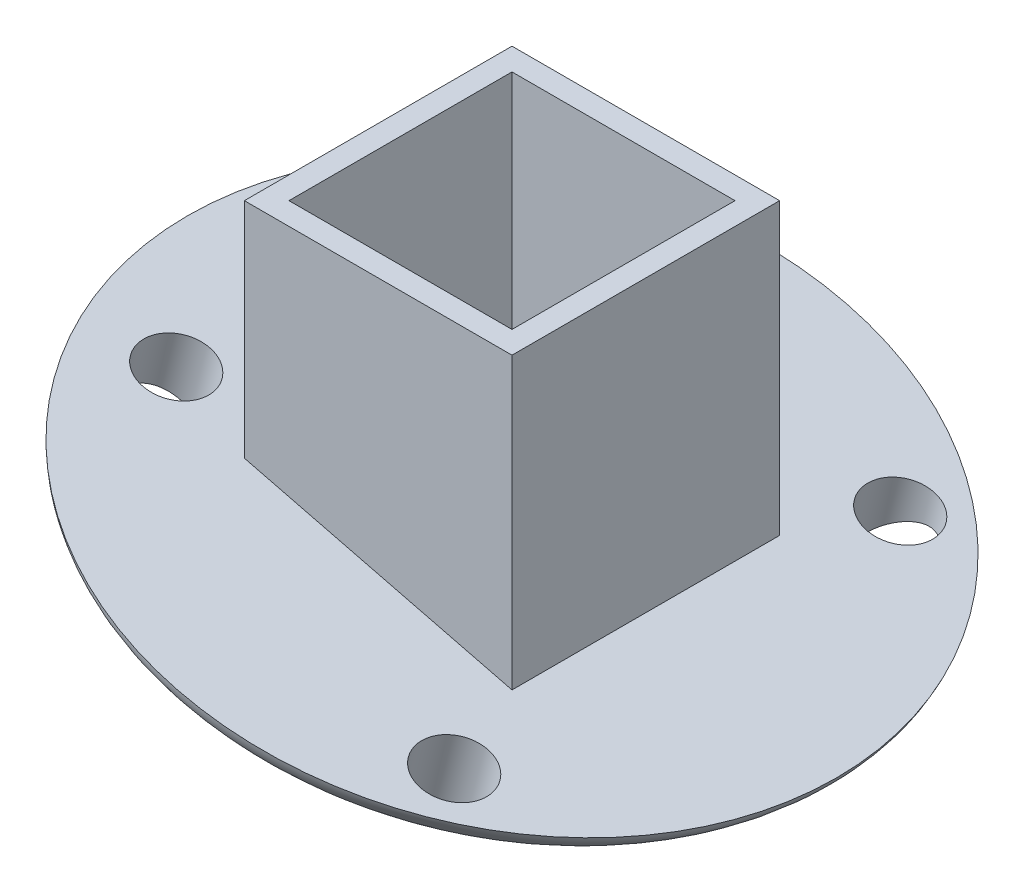
from build123d import *

# Parameters (mm, degrees)
SKETCH_1_W          = 12
SKETCH_1_H          = 12
SKETCH_1_W_2        = 10
SKETCH_1_H_2        = 10
EXTRUDE_1_DEPTH     = 10
SKETCH_2_W          = 12
SKETCH_2_H          = 3
EXTRUDE_2_DEPTH     = 12
CUT_EXTRUDE_1_DEPTH = 12
SKETCH_13_R         = 1.5
CUT_EXTRUDE_3_DEPTH = 5


with BuildPart() as part:
    # 草图1 → 凸台-拉伸1 (new body)
    with BuildSketch(Plane(origin=(0, 0, 0), x_dir=(1, 0, 0), z_dir=(0, 1, 0))):
        Rectangle(SKETCH_1_W, SKETCH_1_H)
        Rectangle(SKETCH_1_W_2, SKETCH_1_H_2, mode=Mode.SUBTRACT)
    extrude(amount=EXTRUDE_1_DEPTH)

    # 草图2 → 凸台-拉伸2 (add)
    with BuildSketch(Plane(origin=(6, 0, 0), x_dir=(0, 0, -1), z_dir=(1, 0, 0))):
        with Locations((0, -1.5)):
            Rectangle(SKETCH_2_W, SKETCH_2_H)
    extrude(amount=-EXTRUDE_2_DEPTH)

    # 草图3 → 切除-拉伸1 (cut)
    with BuildSketch(Plane.XY.offset(6)):
        Polygon((-6, -3), (6, -3), (-6, 0), align=None)
    extrude(amount=-CUT_EXTRUDE_1_DEPTH, mode=Mode.SUBTRACT)

    # 草图12 → 旋转2 (revolve)
    with BuildSketch(Plane.XY):
        with BuildLine():
            Line((6, -3), (0, -1.5))
            Line((0, -1.5), (-1.212678125, -6.350712501))
            add(Edge.make_bspline(
                [(-1.212678125, -6.350712501), (4.875851895, -8.181828142), (13.57045187, -7.289924983), (14.552137502, -5.138034376)],
                knots=[0, 0, 0, 0, 1, 1, 1, 1], degree=3))
            Line((14.552137502, -5.138034376), (6, -3))
        make_face()
    revolve(axis=Axis((0, -1.5, 0), (-0.24253562503633272, -0.970142500145332, 0)))

    # 草图13 → 切除-拉伸3 (cut)
    with BuildSketch(Plane(origin=(-0.352941176, -1.411764706, 0), x_dir=(0.970142500145332, -0.24253562503633286, 0), z_dir=(0.24253562503633286, 0.970142500145332, 0))):
        with Locations(Location((-10, 5, 0), (0, 0, 180))):
            Circle(SKETCH_13_R)
        with Locations(Location((8, 10, 0), (0, 0, 180))):
            Circle(SKETCH_13_R)
        with Locations(Location((8, -10, 0), (0, 0, 180))):
            Circle(SKETCH_13_R)
        with Locations(Location((-10, -5, 0), (0, 0, 180))):
            Circle(SKETCH_13_R)
    extrude(amount=-CUT_EXTRUDE_3_DEPTH, mode=Mode.SUBTRACT)


solid = part.part
